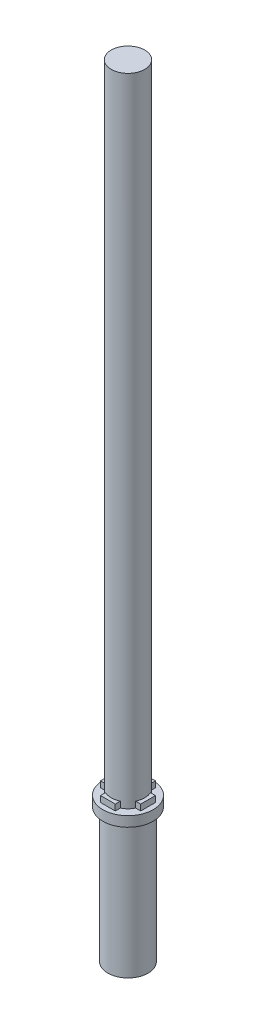
from build123d import *

# Parameters (mm, degrees)
SKETCH_1_R      = 6
SKETCH_1_R_2    = 5.25
EXTRUDE_2_DEPTH = 40
SKETCH_2_R      = 7.5
EXTRUDE_3_DEPTH = 3
SKETCH_3_R      = 5
EXTRUDE_4_DEPTH = 190
EXTRUDE_6_DEPTH = 1.8


with BuildPart() as part:
    # 草图1 → 凸台-拉伸2 (new body)
    with BuildSketch(Plane(origin=(0, 0, 0), x_dir=(1, 0, 0), z_dir=(0, 1, 0))):
        with Locations(Location((0, 0, 0), (0, 0, 270))):
            Circle(SKETCH_1_R)
        with Locations(Location((0, 0, 0), (0, 0, 270))):
            Circle(SKETCH_1_R_2, mode=Mode.SUBTRACT)
    extrude(amount=EXTRUDE_2_DEPTH)

    # 草图2 → 凸台-拉伸3 (add)
    with BuildSketch(Plane(origin=(0, 40, 0), x_dir=(1, 0, 0), z_dir=(0, 1, 0))):
        with Locations(Location((0, 0, 0), (0, 0, 270))):
            Circle(SKETCH_2_R)
    extrude(amount=EXTRUDE_3_DEPTH)

    # 草图3 → 凸台-拉伸4 (add)
    with BuildSketch(Plane(origin=(0, 43, 0), x_dir=(1, 0, 0), z_dir=(0, 1, 0))):
        with Locations(Location((0, 0, 0), (0, 0, 270))):
            Circle(SKETCH_3_R)
    extrude(amount=EXTRUDE_4_DEPTH)

    # 草图4 → 凸台-拉伸6 (add)
    with BuildSketch(Plane(origin=(0, 43, 0), x_dir=(1, 0, 0), z_dir=(0, 1, 0))):
        with BuildLine():
            Line((6, 2.2), (4.489988864, 2.2))
            ThreePointArc((4.489988864, 2.2), (4.870828693, 1.129171307), (5, 0))
            ThreePointArc((5, 0), (4.870828693, -1.129171307), (4.489988864, -2.2))
            Line((4.489988864, -2.2), (6, -2.2))
            Line((6, -2.2), (6, 2.2))
        make_face()
        with BuildLine():
            ThreePointArc((2.2, -4.489988864), (0, -5), (-2.2, -4.489988864))
            Line((-2.2, -4.489988864), (-2.2, -6))
            Line((-2.2, -6), (2.2, -6))
            Line((2.2, -6), (2.2, -4.489988864))
        make_face()
        with BuildLine():
            Line((-2.2, 6), (-2.2, 4.489988864))
            ThreePointArc((-2.2, 4.489988864), (0, 5), (2.2, 4.489988864))
            Line((2.2, 4.489988864), (2.2, 6))
            Line((2.2, 6), (-2.2, 6))
        make_face()
        with BuildLine():
            ThreePointArc((-4.489988864, -2.2), (-5, 0), (-4.489988864, 2.2))
            Line((-4.489988864, 2.2), (-6, 2.2))
            Line((-6, 2.2), (-6, -2.2))
            Line((-6, -2.2), (-4.489988864, -2.2))
        make_face()
    extrude(amount=EXTRUDE_6_DEPTH)


solid = part.part
